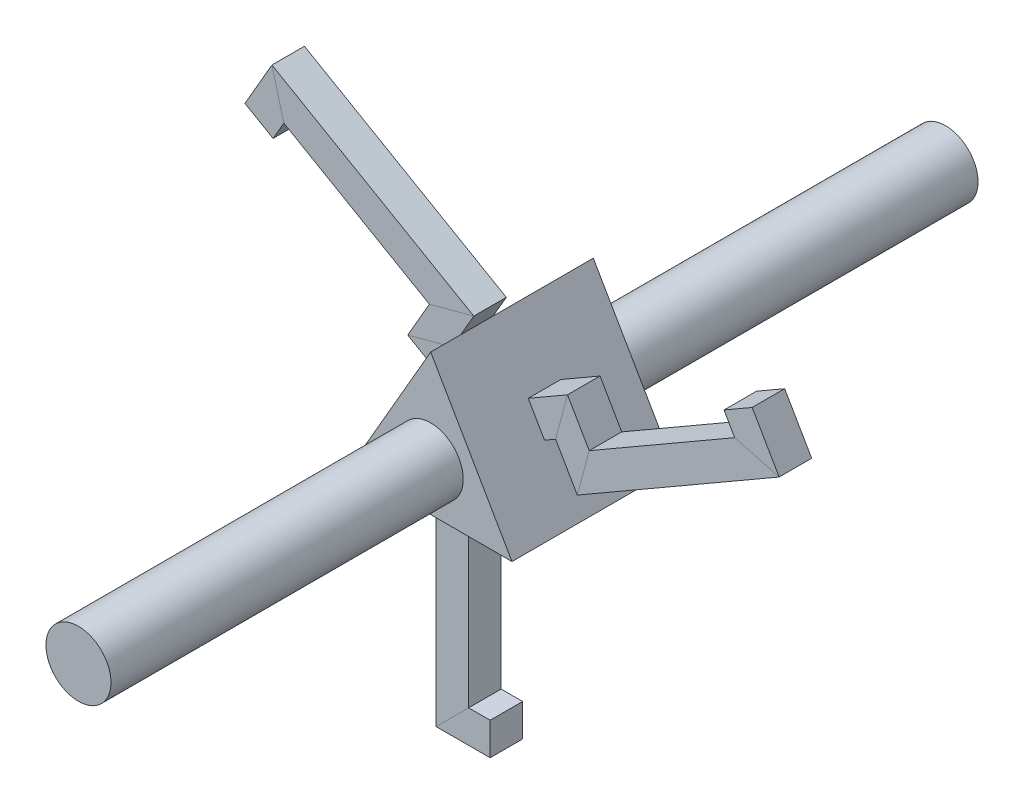
from build123d import *

# Parameters (mm, degrees)
BOSS_EXTRU_1_DEPTH           = 75
ESQUISSE3_R                  = 15
BOSS_EXTRU_2_DEPTH           = 162.5
BOSS_EXTRU_3_START           = 162.5
ESQUISSE4_R                  = 15
BOSS_EXTRU_3_DEPTH           = 162.5
ESQUISSE5_W                  = 15
ESQUISSE5_H                  = 15
R_P_TITION_CIRCULAIRE2_COUNT = 3


with BuildPart() as part:
    # Esquisse1 → Boss.-Extru.1 (new body)
    with BuildSketch(Plane.XY):
        Polygon((-20.36542333, 6.148938206), (-57.86542333, -58.802967077), (17.13457667, -58.802967077), align=None)
    extrude(amount=BOSS_EXTRU_1_DEPTH)

    # Esquisse3 → Boss.-Extru.2 (add)
    with BuildSketch(Plane.XY.offset(75)):
        with Locations((-20.36542333, -37.152331983)):
            Circle(ESQUISSE3_R)
    extrude(amount=BOSS_EXTRU_2_DEPTH)

    # Esquisse4 → Boss.-Extru.3 (add)
    with BuildSketch(Plane(origin=(0, 0, 0), x_dir=(-1, 0, 0), z_dir=(0, 0, -1)).offset(BOSS_EXTRU_3_START)):
        with Locations(Location((20.36542333, -37.152331983, 0), (0, 0, 180))):
            Circle(ESQUISSE4_R)
    extrude(amount=-BOSS_EXTRU_3_DEPTH)

    # Balayage1: sweep along a curve in space
    with BuildLine() as balayage1_path:
        Line((-12.950526791, -56.834039487, 37.5), (-12.950526791, -79.630989253, 37.5))
        Line((-12.950526791, -79.630989253, 37.5), (-32.950526791, -79.630989253, 37.5))
        Line((-32.950526791, -79.630989253, 37.5), (-32.950526791, -157.328083579, 37.5))
        Line((-32.950526791, -157.328083579, 37.5), (-22.950526791, -157.328083579, 37.5))
    # Esquisse5 → Balayage1 (sweep)
    with BuildSketch(Plane.XZ.offset(58.802967077)):
        with Locations((-20.36542333, 37.5)):
            Rectangle(ESQUISSE5_W, ESQUISSE5_H)
    balayage1 = sweep(path=balayage1_path.line, transition=Transition.RIGHT)

    # Répétition circulaire2: Balayage1 ×3 about axis
    r_p_tition_circulaire2_axis = Axis((-20.36542333, -37.152331983, 0), (0, 0, 1))
    for i in range(1, R_P_TITION_CIRCULAIRE2_COUNT):
        add(balayage1.rotate(r_p_tition_circulaire2_axis, i * 360 / R_P_TITION_CIRCULAIRE2_COUNT))


solid = part.part
